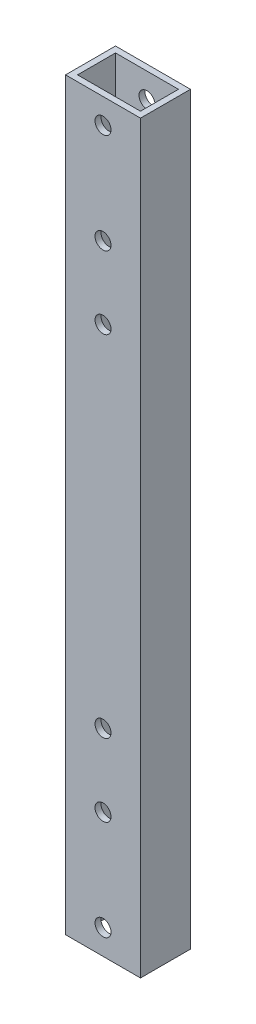
from build123d import *

# Parameters (mm, degrees)
SKETCH_1_W          = 15
SKETCH_1_H          = 10
SKETCH_1_W_2        = 12.6
SKETCH_1_H_2        = 7.6
EXTRUDE_1_DEPTH     = 74.51
SKETCH_3_R          = 1.6
CUT_EXTRUDE_1_DEPTH = 10


with BuildPart() as part:
    # ｽｹｯﾁ1 → ﾎﾞｽ - 押し出し1 (new, symmetric)
    with BuildSketch(Plane(origin=(0, 0, 0), x_dir=(1, 0, 0), z_dir=(0, 1, 0))):
        Rectangle(SKETCH_1_W, SKETCH_1_H)
        Rectangle(SKETCH_1_W_2, SKETCH_1_H_2, mode=Mode.SUBTRACT)
    extrude(amount=EXTRUDE_1_DEPTH, both=True)

    # ｽｹｯﾁ3 → ｶｯﾄ - 押し出し1 (cut)
    with BuildSketch(Plane.XY.offset(5)):
        with Locations((0, 49.51)):
            Circle(SKETCH_3_R)
        with Locations((0, 69.51)):
            Circle(SKETCH_3_R)
        with Locations((0, 35)):
            Circle(SKETCH_3_R)
    cut_extrude_1 = extrude(amount=-CUT_EXTRUDE_1_DEPTH, mode=Mode.SUBTRACT)

    # ﾐﾗｰ1: ｶｯﾄ - 押し出し1 across plane
    add(cut_extrude_1.mirror(Plane.ZX), mode=Mode.SUBTRACT)


solid = part.part
